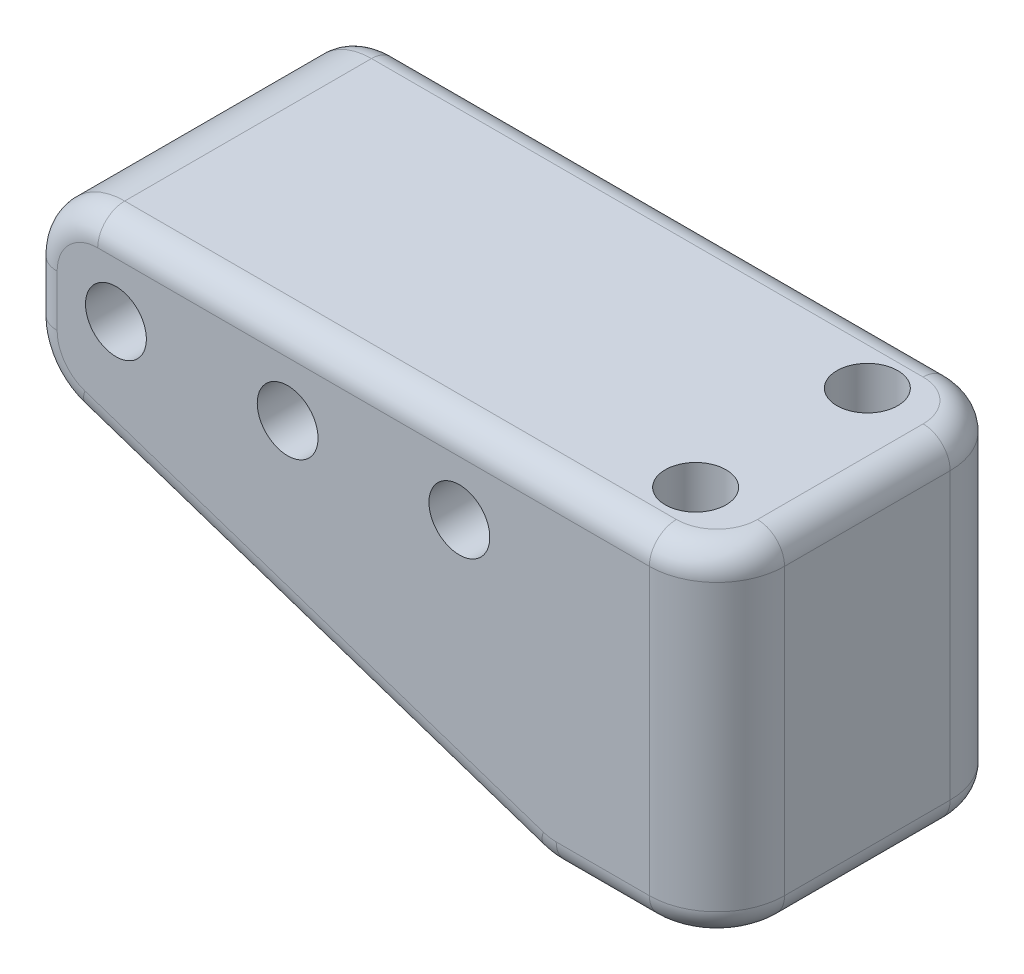
from build123d import *

# Parameters (mm, degrees)
SKETCH1_R           = 2.25
BOSS_EXTRUDE1_DEPTH = 22.2504
CUT_EXTRUDE1_REACH  = 57.683
SKETCH2_R           = 2.25
FILLET1_R           = 5
FILLET2_R           = 2


with BuildPart() as part:
    # Sketch1 → Boss-Extrude1 (new body)
    with BuildSketch(Plane.XY):
        Polygon((-6.35, -6.35), (31.75, -19.05), (44.45, -19.05), (44.45, 6.0452), (-6.35, 6.0452), align=None)
        with Locations(Location((0, 0, 0), (0, 0, 180))):
            Circle(SKETCH1_R, mode=Mode.SUBTRACT)
        with Locations(Location((12.7, 0, 0), (0, 0, 180))):
            Circle(SKETCH1_R, mode=Mode.SUBTRACT)
        with Locations(Location((25.4, 0, 0), (0, 0, 180))):
            Circle(SKETCH1_R, mode=Mode.SUBTRACT)
    extrude(amount=BOSS_EXTRUDE1_DEPTH)

    # Sketch2 → Cut-Extrude1 (cut, up to next)
    with BuildSketch(Plane(origin=(0, 6.0452, 0), x_dir=(1, 0, 0), z_dir=(0, 1, 0)), mode=Mode.PRIVATE) as cut_extrude1_sk1:
        with Locations(Location((38.1, -17.4752, 0), (0, 0, 270))):
            Circle(SKETCH2_R)
    cut_extrude1_tool1 = extrude(cut_extrude1_sk1.sketch, amount=-CUT_EXTRUDE1_REACH, mode=Mode.PRIVATE) & part.part
    # Sketch2 → Cut-Extrude1 (cut, up to next)
    with BuildSketch(Plane(origin=(0, 6.0452, 0), x_dir=(1, 0, 0), z_dir=(0, 1, 0)), mode=Mode.PRIVATE) as cut_extrude1_sk2:
        with Locations(Location((38.1, -4.7752, 0), (0, 0, 270))):
            Circle(SKETCH2_R)
    cut_extrude1_tool2 = extrude(cut_extrude1_sk2.sketch, amount=-CUT_EXTRUDE1_REACH, mode=Mode.PRIVATE) & part.part
    add(cut_extrude1_tool1.solids().sort_by_distance((38.1, 6.0452, 17.4752))[0], mode=Mode.SUBTRACT)
    add(cut_extrude1_tool2.solids().sort_by_distance((38.1, 6.0452, 4.7752))[0], mode=Mode.SUBTRACT)

    # Fillet1
    fillet1_edges = [part.edges().sort_by_distance(p)[0] for p in [
        (44.45, -6.5024, 0),
        (44.45, -6.5024, 22.2504),
        (31.75, -19.05, 11.1252),
        (-6.35, -6.35, 11.1252),
        (-6.35, 6.0452, 11.1252),
    ]]
    fillet(fillet1_edges, radius=FILLET1_R)

    # Fillet2
    fillet2_edges = [part.edges().sort_by_distance(p)[0] for p in [
        (36.00569415, -19.05, 0),
        (44.45, -19.05, 11.1252),
        (36.00569415, -19.05, 22.2504),
        (42.985533906, -19.05, 20.785933906),
        (42.985533906, -19.05, 1.464466094),
        (14.02455532, -13.14151844, 0),
        (-6.35, -0.85050195, 0),
        (19.05, 6.0452, 0),
        (-4.885533906, 4.580733906, 0),
        (-5.406210926, -5.669755323, 0),
        (31.760477086, -18.985437288, 0),
        (14.02455532, -13.14151844, 22.2504),
        (19.05, 6.0452, 22.2504),
        (-6.35, -0.85050195, 22.2504),
        (-4.885533906, 4.580733906, 22.2504),
        (-5.406210926, -5.669755323, 22.2504),
        (31.760477086, -18.985437288, 22.2504),
        (44.45, 6.0452, 11.1252),
        (42.985533906, 6.0452, 20.785933906),
        (42.985533906, 6.0452, 1.464466094),
    ]]
    fillet(fillet2_edges, radius=FILLET2_R)


solid = part.part
